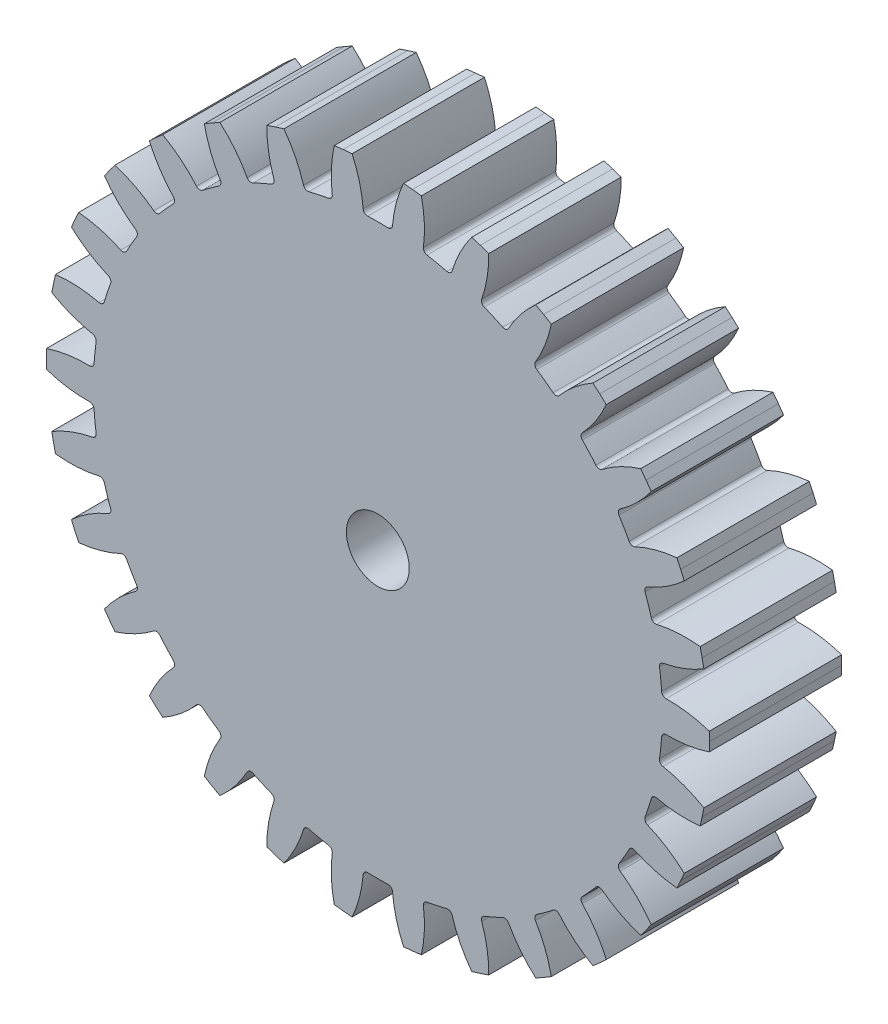
from build123d import *

# Parameters (mm, degrees)
BOSS_EXTRUDE1_DEPTH      = 10
FILLET1_R                = 0.3325
CIRPATTERN1_COUNT        = 30
FILLET1_OF_CIRPATTERN1_R = 0.3325
CUT_EXTRUDE1_REACH       = 38.759
SKETCH2_R                = 2.375


with BuildPart() as part:
    # Sketch1 → Boss-Extrude1 (new body)
    with BuildSketch(Plane.XY):
        with BuildLine():
            Line((25.040834221, 0.677585061), (25.05, 0))
            Line((25.05, 0), (25.040834221, -0.677585061))
            ThreePointArc((25.040834221, -0.677585061), (23.273874213, -1.0893045), (21.461049387, -1.162288888))
            ThreePointArc((21.461049387, -1.162288888), (21.424766078, -1.704979397), (21.374761836, -2.246577997))
            Line((21.374761836, -2.246577997), (0, 0))
            Line((0, 0), (21.374761836, 2.246577997))
            ThreePointArc((21.374761836, 2.246577997), (21.424766078, 1.704979397), (21.461049387, 1.162288888))
            ThreePointArc((21.461049387, 1.162288888), (23.273874213, 1.0893045), (25.040834221, 0.677585061))
        make_face()
    boss_extrude1 = extrude(amount=BOSS_EXTRUDE1_DEPTH)

    # Fillet1
    fillet1_edges = [part.edges().sort_by_distance(p)[0] for p in [
        (21.461049387, 1.162288888, 5),
        (21.461049387, -1.162288888, 5),
    ]]
    fillet(fillet1_edges, radius=FILLET1_R)

    # CirPattern1: Boss-Extrude1 ×30 about axis
    cirpattern1_axis = Axis((0, 0, 0), (0, 0, 1))
    for i in range(1, CIRPATTERN1_COUNT):
        add(boss_extrude1.rotate(cirpattern1_axis, i * 360 / CIRPATTERN1_COUNT))

    # Fillet1 of CirPattern1
    fillet1_of_cirpattern1_edges = [part.edges().sort_by_distance(p)[0] for p in [
        (20.750420519, 5.598893152, 5),
        (21.233727415, 3.325112978, 5),
        (19.132898703, 9.790798919, 5),
        (20.078389664, 7.66719145, 5),
        (16.679177404, 13.554799791, 5),
        (18.045529939, 11.674176866, 5),
        (13.496496017, 16.72639087, 5),
        (15.223993962, 15.170944733, 5),
        (9.72395299, 19.166958405, 5),
        (11.737096397, 18.004669517, 5),
        (5.526426557, 20.769837885, 5),
        (7.737231399, 20.051503847, 5),
        (1.087368765, 21.464975784, 5),
        (3.39921226, 21.221991242, 5),
        (-3.39921226, 21.221991242, 5),
        (-1.087368765, 21.464975784, 5),
        (-7.737231399, 20.051503847, 5),
        (-5.526426557, 20.769837885, 5),
        (-11.737096397, 18.004669517, 5),
        (-9.72395299, 19.166958405, 5),
        (-15.223993962, 15.170944733, 5),
        (-13.496496017, 16.72639087, 5),
        (-18.045529939, 11.674176866, 5),
        (-16.679177404, 13.554799791, 5),
        (-20.078389664, 7.66719145, 5),
        (-19.132898703, 9.790798919, 5),
        (-21.233727415, 3.325112978, 5),
        (-20.750420519, 5.598893152, 5),
        (-21.461049387, -1.162288888, 5),
        (-21.461049387, 1.162288888, 5),
        (-20.750420519, -5.598893152, 5),
        (-21.233727415, -3.325112978, 5),
        (-19.132898703, -9.790798919, 5),
        (-20.078389664, -7.66719145, 5),
        (-16.679177404, -13.554799791, 5),
        (-18.045529939, -11.674176866, 5),
        (-13.496496017, -16.72639087, 5),
        (-15.223993962, -15.170944733, 5),
        (-9.72395299, -19.166958405, 5),
        (-11.737096397, -18.004669517, 5),
        (-5.526426557, -20.769837885, 5),
        (-7.737231399, -20.051503847, 5),
        (-1.087368765, -21.464975784, 5),
        (-3.39921226, -21.221991242, 5),
        (3.39921226, -21.221991242, 5),
        (1.087368765, -21.464975784, 5),
        (7.737231399, -20.051503847, 5),
        (5.526426557, -20.769837885, 5),
        (11.737096397, -18.004669517, 5),
        (9.72395299, -19.166958405, 5),
        (15.223993962, -15.170944733, 5),
        (13.496496017, -16.72639087, 5),
        (18.045529939, -11.674176866, 5),
        (16.679177404, -13.554799791, 5),
        (20.078389664, -7.66719145, 5),
        (19.132898703, -9.790798919, 5),
        (21.233727415, -3.325112978, 5),
        (20.750420519, -5.598893152, 5),
    ]]
    fillet(fillet1_of_cirpattern1_edges, radius=FILLET1_OF_CIRPATTERN1_R)

    # Sketch2 → Cut-Extrude1 (cut, up to next)
    with BuildSketch(Plane(origin=(0, 0, 0), x_dir=(-1, 0, 0), z_dir=(0, 0, -1)), mode=Mode.PRIVATE) as cut_extrude1_sk1:
        Circle(SKETCH2_R)
    cut_extrude1_tool1 = extrude(cut_extrude1_sk1.sketch, amount=-CUT_EXTRUDE1_REACH, mode=Mode.PRIVATE) & part.part
    add(cut_extrude1_tool1.solids().sort_by_distance((0, 0, 0))[0], mode=Mode.SUBTRACT)


solid = part.part
